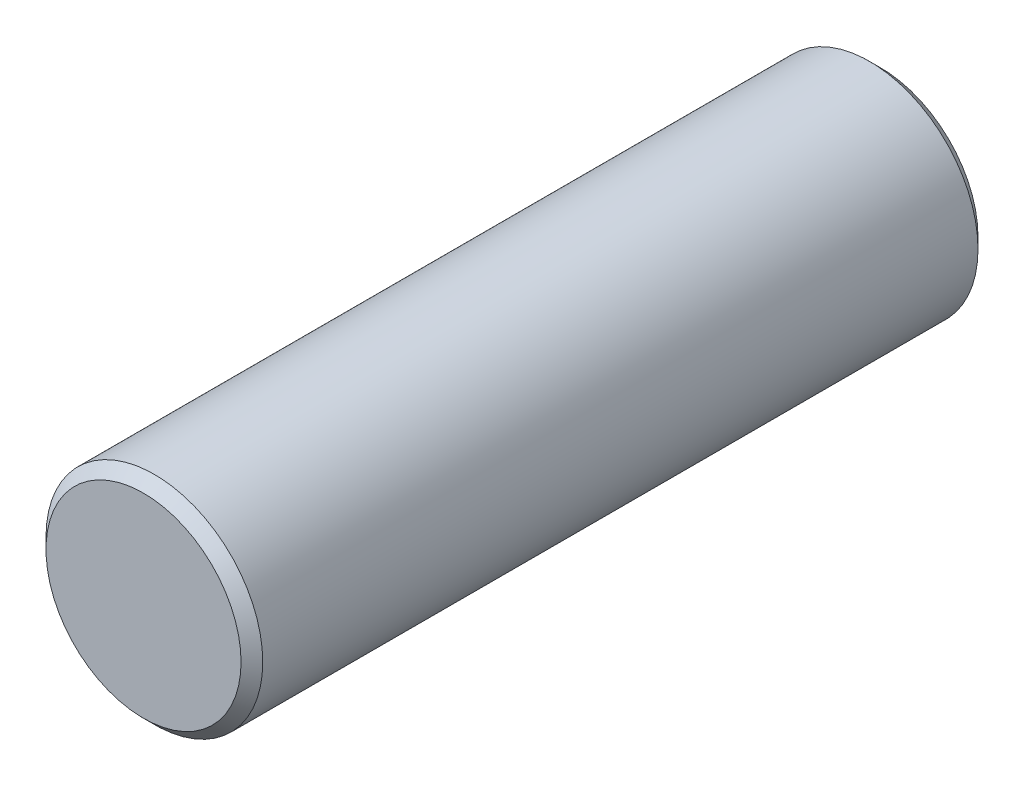
from build123d import *

# Parameters (mm, degrees)
SKETCH1_R           = 5
BOSS_EXTRUDE1_DEPTH = 17
CHAMFER1_SIZE       = 0.5


with BuildPart() as part:
    # Sketch1 → Boss-Extrude1 (new, symmetric)
    with BuildSketch(Plane.XY):
        Circle(SKETCH1_R)
    extrude(amount=BOSS_EXTRUDE1_DEPTH, both=True)

    # Chamfer1
    chamfer1_edges = [part.edges().sort_by_distance(p)[0] for p in [
        (-5, 0, -17),
        (-5, 0, 17),
    ]]
    chamfer(chamfer1_edges, length=CHAMFER1_SIZE)


solid = part.part
